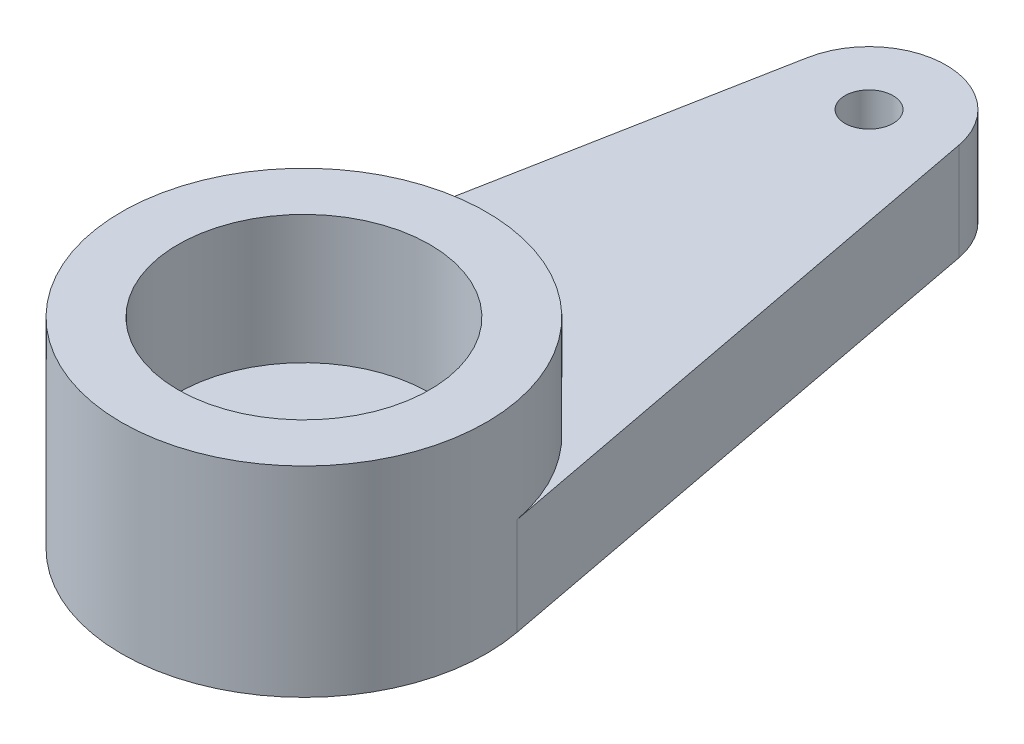
from build123d import *

# Parameters (mm, degrees)
BOSS_EXTRUDE1_DEPTH     = 1.9
SKETCH2_R               = 3.55
SKETCH2_R_2             = 2.45
BOSS_EXTRUDE2_DEPTH     = 2
CUT_EXTRUDE1_START      = -2.5
SKETCH3_R               = 2.45
CUT_EXTRUDE1_DEPTH      = 2.5
CUT_EXTRUDE2_DEPTH      = 14.232630124
CUT_EXTRUDE2_DEPTH_BACK = 14.232630124
SKETCH4_R               = 0.468509015
SKETCH4_R_2             = 0.881877008


with BuildPart() as part:
    # Sketch1 → Boss-Extrude1 (new body)
    with BuildSketch(Plane(origin=(0, 0, 0), x_dir=(1, 0, 0), z_dir=(0, 1, 0))):
        with BuildLine():
            Line((-3.487806971, 0.661590909), (-1.473721255, 11.279545455))
            ThreePointArc((-1.473721255, 11.279545455), (0, 12.5), (1.473721255, 11.279545455))
            Line((1.473721255, 11.279545455), (3.487806971, 0.661590909))
            ThreePointArc((3.487806971, 0.661590909), (0, -3.55), (-3.487806971, 0.661590909))
        make_face()
    extrude(amount=BOSS_EXTRUDE1_DEPTH)

    # Sketch2 → Boss-Extrude2 (add)
    with BuildSketch(Plane(origin=(0, 1.9, 0), x_dir=(1, 0, 0), z_dir=(0, 1, 0))):
        with Locations(Location((0, 0, 0), (0, 0, 10.740645756))):
            Circle(SKETCH2_R)
        with Locations(Location((0, 0, 0), (0, 0, 270))):
            Circle(SKETCH2_R_2, mode=Mode.SUBTRACT)
    extrude(amount=BOSS_EXTRUDE2_DEPTH)

    # Sketch3 → Cut-Extrude1 (cut)
    with BuildSketch(Plane(origin=(0, 3.9, 0), x_dir=(1, 0, 0), z_dir=(0, 1, 0)).offset(CUT_EXTRUDE1_START)):
        with Locations(Location((0, 0, 0), (0, 0, 270))):
            Circle(SKETCH3_R)
    extrude(amount=CUT_EXTRUDE1_DEPTH, mode=Mode.SUBTRACT)

    # Sketch4 → Cut-Extrude2 (cut, two sides: drawn at the far end of the back side and taken through both)
    with BuildSketch(Plane(origin=(0, 1.4, 0), x_dir=(1, 0, 0), z_dir=(0, 1, 0)).offset(-CUT_EXTRUDE2_DEPTH_BACK)):
        with Locations(Location((0, 11, 0), (0, 0, 270))):
            Circle(SKETCH4_R)
        with Locations(Location((0, 0, 0), (0, 0, 270))):
            Circle(SKETCH4_R_2)
    extrude(amount=CUT_EXTRUDE2_DEPTH + CUT_EXTRUDE2_DEPTH_BACK, mode=Mode.SUBTRACT)


solid = part.part
